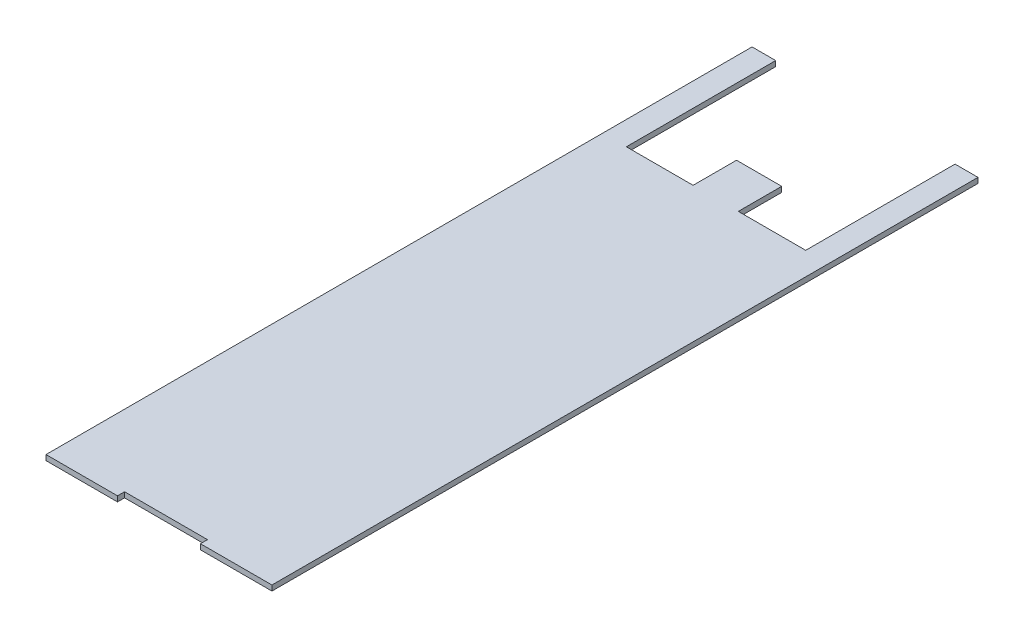
from build123d import *

# Parameters (mm, degrees)
BOSS_EXTRUDE1_DEPTH = 3
SKETCH2_W           = 47
SKETCH2_H           = 8
CUT_EXTRUDE1_DEPTH  = 10


with BuildPart() as part:
    # Sketch1 → Boss-Extrude1 (new body)
    with BuildSketch(Plane.XZ.offset(548.298939869)):
        Polygon((-175.210843614, 789.620141885), (-47.210843614, 789.620141885), (-47.210843614, 389.620141885), (-60.218241118, 389.620141885), (-60.218241118, 474.220141885), (-98.410843614, 474.220141885), (-98.410843614, 449.620141885), (-124.010843614, 449.620141885), (-124.010843614, 474.220141885), (-161.818241118, 474.220141885), (-161.818241118, 389.620141885), (-175.210843614, 389.620141885), align=None)
    extrude(amount=BOSS_EXTRUDE1_DEPTH)

    # Sketch2 → Cut-Extrude1 (cut)
    with BuildSketch(Plane(origin=(0, -548.298939869, 0), x_dir=(1, 0, 0), z_dir=(0, 1, 0))):
        with Locations((-111.210843614, -789.620141885)):
            Rectangle(SKETCH2_W, SKETCH2_H)
    extrude(amount=-CUT_EXTRUDE1_DEPTH, mode=Mode.SUBTRACT)


solid = part.part
